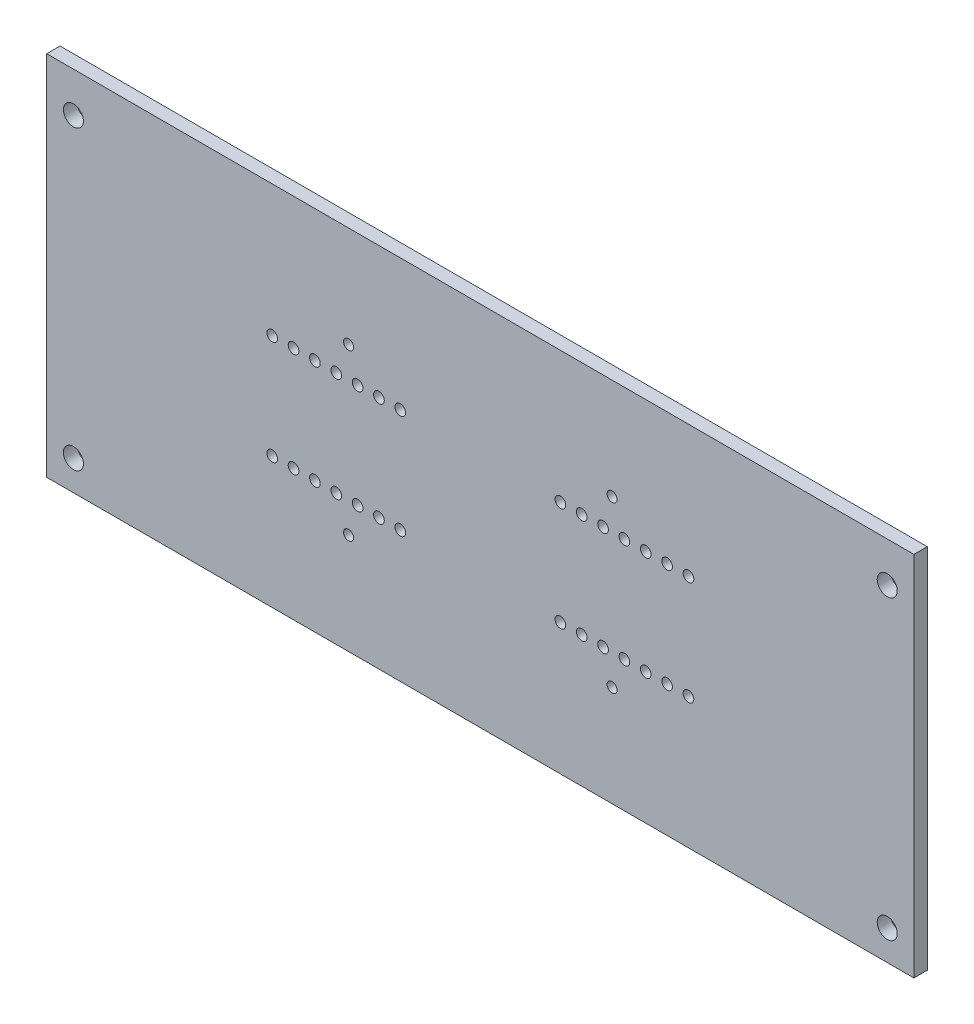
from build123d import *

# Parameters (mm, degrees)
SKETCH1_W           = 260
SKETCH1_H           = 110
BOSS_EXTRUDE1_DEPTH = 4
SKETCH2_R           = 3
CUT_EXTRUDE1_DEPTH  = 142.21260567
SKETCH5_R           = 1.5
CUT_EXTRUDE3_DEPTH  = 142.21260567
SKETCH6_R           = 1.6
CUT_EXTRUDE4_DEPTH  = 142.21260567
SKETCH7_R           = 3
BOSS_EXTRUDE2_DEPTH = 4


with BuildPart() as part:
    # Sketch1 → Boss-Extrude1 (new body)
    with BuildSketch(Plane.XY):
        Rectangle(SKETCH1_W, SKETCH1_H)
    extrude(amount=BOSS_EXTRUDE1_DEPTH)

    # Sketch2 → Cut-Extrude1 (cut, through all)
    with BuildSketch(Plane(origin=(0, 0, 0), x_dir=(-1, 0, 0), z_dir=(0, 0, -1))):
        with Locations((-122, 43)):
            Circle(SKETCH2_R)
        with Locations((122, 43)):
            Circle(SKETCH2_R)
        with Locations((75, 43)):
            Circle(SKETCH2_R)
        with Locations((122, -46)):
            Circle(SKETCH2_R)
        with Locations((-75, 43)):
            Circle(SKETCH2_R)
        with Locations((-122, -46)):
            Circle(SKETCH2_R)
    extrude(amount=-CUT_EXTRUDE1_DEPTH, mode=Mode.SUBTRACT)

    # Sketch5 → Cut-Extrude3 (cut, through all)
    with BuildSketch(Plane.XY.offset(4)):
        with Locations((-39.5, 24.75)):
            Circle(SKETCH5_R)
        with Locations((39.5, 24.75)):
            Circle(SKETCH5_R)
        with Locations((39.5, -24.75)):
            Circle(SKETCH5_R)
        with Locations((-39.5, -24.75)):
            Circle(SKETCH5_R)
    extrude(amount=-CUT_EXTRUDE3_DEPTH, mode=Mode.SUBTRACT)

    # Sketch6 → Cut-Extrude4 (cut, through all)
    with BuildSketch(Plane.XY.offset(4)):
        with Locations((-24, 15.549418684)):
            Circle(SKETCH6_R)
        with Locations((-30.4, 15.549418684)):
            Circle(SKETCH6_R)
        with Locations((-36.8, 15.549418684)):
            Circle(SKETCH6_R)
        with Locations((-43.2, 15.549418684)):
            Circle(SKETCH6_R)
        with Locations((-49.6, 15.549418684)):
            Circle(SKETCH6_R)
        with Locations((-56, 15.549418684)):
            Circle(SKETCH6_R)
        with Locations((-62.4, 15.549418684)):
            Circle(SKETCH6_R)
        with Locations((-62.4, -15.650581316)):
            Circle(SKETCH6_R)
        with Locations((-56, -15.650581316)):
            Circle(SKETCH6_R)
        with Locations((-49.6, -15.650581316)):
            Circle(SKETCH6_R)
        with Locations((-43.2, -15.650581316)):
            Circle(SKETCH6_R)
        with Locations((-36.8, -15.650581316)):
            Circle(SKETCH6_R)
        with Locations((-30.4, -15.650581316)):
            Circle(SKETCH6_R)
        with Locations((-24, -15.650581316)):
            Circle(SKETCH6_R)
        with Locations(Location((24, -15.650581316, 0), (0, 0, 180))):
            Circle(SKETCH6_R)
        with Locations(Location((30.4, -15.650581316, 0), (0, 0, 180))):
            Circle(SKETCH6_R)
        with Locations(Location((36.8, -15.650581316, 0), (0, 0, 180))):
            Circle(SKETCH6_R)
        with Locations(Location((43.2, -15.650581316, 0), (0, 0, 180))):
            Circle(SKETCH6_R)
        with Locations(Location((49.6, -15.650581316, 0), (0, 0, 180))):
            Circle(SKETCH6_R)
        with Locations(Location((56, -15.650581316, 0), (0, 0, 180))):
            Circle(SKETCH6_R)
        with Locations(Location((62.4, -15.650581316, 0), (0, 0, 180))):
            Circle(SKETCH6_R)
        with Locations(Location((62.4, 15.549418684, 0), (0, 0, 180))):
            Circle(SKETCH6_R)
        with Locations(Location((56, 15.549418684, 0), (0, 0, 180))):
            Circle(SKETCH6_R)
        with Locations(Location((49.6, 15.549418684, 0), (0, 0, 180))):
            Circle(SKETCH6_R)
        with Locations(Location((43.2, 15.549418684, 0), (0, 0, 180))):
            Circle(SKETCH6_R)
        with Locations(Location((36.8, 15.549418684, 0), (0, 0, 180))):
            Circle(SKETCH6_R)
        with Locations(Location((30.4, 15.549418684, 0), (0, 0, 180))):
            Circle(SKETCH6_R)
        with Locations(Location((24, 15.549418684, 0), (0, 0, 180))):
            Circle(SKETCH6_R)
    extrude(amount=-CUT_EXTRUDE4_DEPTH, mode=Mode.SUBTRACT)

    # Sketch7 → Boss-Extrude2 (add)
    with BuildSketch(Plane(origin=(0, 0, 0), x_dir=(-1, 0, 0), z_dir=(0, 0, -1))):
        with Locations((75, 43)):
            Circle(SKETCH7_R)
        with Locations((-75, 43)):
            Circle(SKETCH7_R)
    extrude(amount=-BOSS_EXTRUDE2_DEPTH)


solid = part.part
